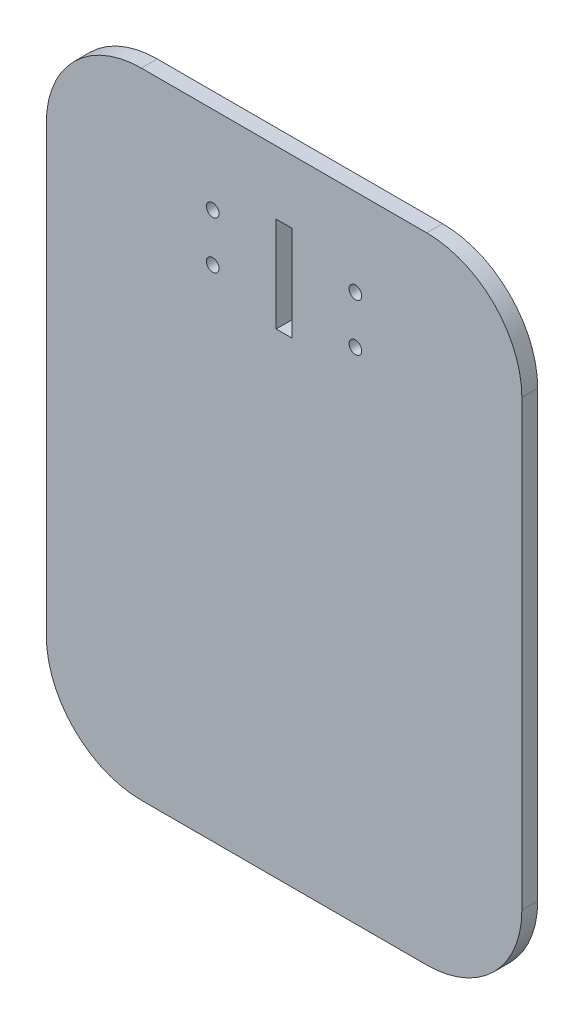
from build123d import *

# Parameters (mm, degrees)
CROQUIS1_W              = 150
CROQUIS1_H              = 200
CROQUIS1_W_2            = 5
CROQUIS1_H_2            = 30
SALIENTE_EXTRUIR1_DEPTH = 5
REDONDEO1_R             = 30
CORTAR_EXTRUIR1_REACH   = 281.518
CROQUIS2_R              = 2


with BuildPart() as part:
    # Croquis1 → Saliente-Extruir1 (new body)
    with BuildSketch(Plane.XY):
        with Locations((-167.295474365, 39.278017241)):
            Rectangle(CROQUIS1_W, CROQUIS1_H)
        with Locations((-167.295474365, 104.278017241)):
            Rectangle(CROQUIS1_W_2, CROQUIS1_H_2, mode=Mode.SUBTRACT)
    extrude(amount=SALIENTE_EXTRUIR1_DEPTH)

    # Redondeo1
    redondeo1_edges = [part.edges().sort_by_distance(p)[0] for p in [
        (-242.295474365, 139.278017241, 2.5),
        (-92.295474365, 139.278017241, 2.5),
        (-92.295474365, -60.721982759, 2.5),
        (-242.295474365, -60.721982759, 2.5),
    ]]
    fillet(redondeo1_edges, radius=REDONDEO1_R)

    # Croquis2 → Cortar-Extruir1 (cut, up to next)
    with BuildSketch(Plane.XY.offset(5), mode=Mode.PRIVATE) as cortar_extruir1_sk1:
        with Locations((-144.795474365, 111.778017241)):
            Circle(CROQUIS2_R)
    cortar_extruir1_tool1 = extrude(cortar_extruir1_sk1.sketch, amount=-CORTAR_EXTRUIR1_REACH, mode=Mode.PRIVATE) & part.part
    # Croquis2 → Cortar-Extruir1 (cut, up to next)
    with BuildSketch(Plane.XY.offset(5), mode=Mode.PRIVATE) as cortar_extruir1_sk2:
        with Locations((-189.795474365, 111.778017241)):
            Circle(CROQUIS2_R)
    cortar_extruir1_tool2 = extrude(cortar_extruir1_sk2.sketch, amount=-CORTAR_EXTRUIR1_REACH, mode=Mode.PRIVATE) & part.part
    # Croquis2 → Cortar-Extruir1 (cut, up to next)
    with BuildSketch(Plane.XY.offset(5), mode=Mode.PRIVATE) as cortar_extruir1_sk3:
        with Locations((-189.795474365, 96.778017241)):
            Circle(CROQUIS2_R)
    cortar_extruir1_tool3 = extrude(cortar_extruir1_sk3.sketch, amount=-CORTAR_EXTRUIR1_REACH, mode=Mode.PRIVATE) & part.part
    # Croquis2 → Cortar-Extruir1 (cut, up to next)
    with BuildSketch(Plane.XY.offset(5), mode=Mode.PRIVATE) as cortar_extruir1_sk4:
        with Locations((-144.795474365, 96.778017241)):
            Circle(CROQUIS2_R)
    cortar_extruir1_tool4 = extrude(cortar_extruir1_sk4.sketch, amount=-CORTAR_EXTRUIR1_REACH, mode=Mode.PRIVATE) & part.part
    add(cortar_extruir1_tool1.solids().sort_by_distance((-144.795474, 111.778017, 5))[0], mode=Mode.SUBTRACT)
    add(cortar_extruir1_tool2.solids().sort_by_distance((-189.795474, 111.778017, 5))[0], mode=Mode.SUBTRACT)
    add(cortar_extruir1_tool3.solids().sort_by_distance((-189.795474, 96.778017, 5))[0], mode=Mode.SUBTRACT)
    add(cortar_extruir1_tool4.solids().sort_by_distance((-144.795474, 96.778017, 5))[0], mode=Mode.SUBTRACT)


solid = part.part
